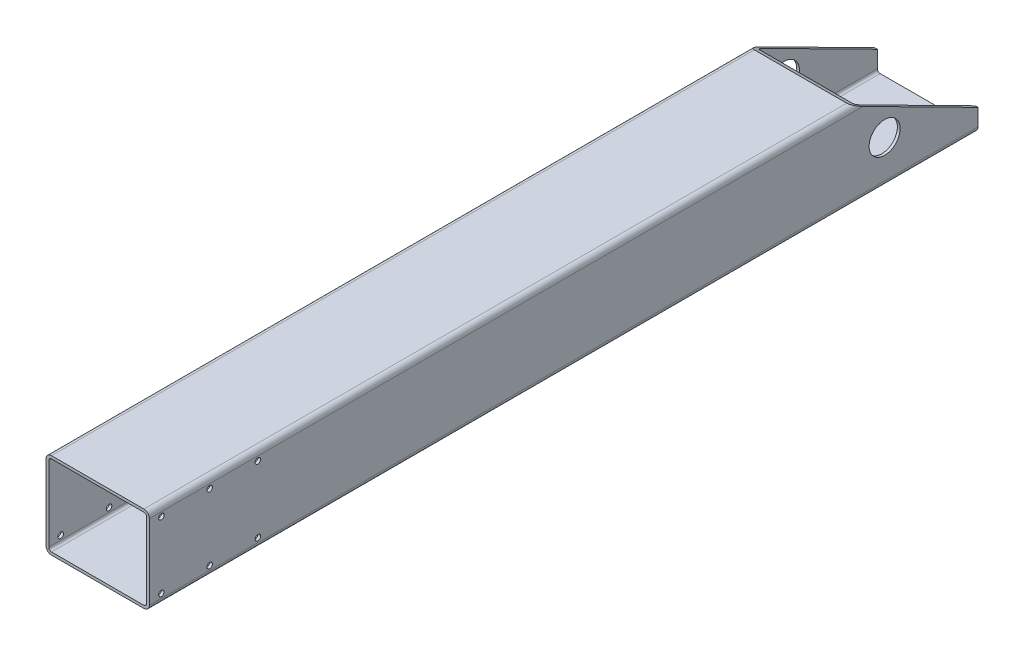
from build123d import *

# Parameters (mm, degrees)
EXTRUDE_1_DEPTH     = 2405
SKETCH_2_R          = 8
SKETCH_2_R_2        = 45
CUT_EXTRUDE_1_DEPTH = 2427.860111337
CUT_EXTRUDE_2_REACH = 2424.607
SKETCH_3_W          = 70
SKETCH_3_H          = 90


with BuildPart() as part:
    # 草图1 → 凸台-拉伸1 (new body)
    with BuildSketch(Plane.XY):
        with BuildLine():
            Line((-134, 125), (134, 125))
            ThreePointArc((134, 125), (145.313708499, 120.313708499), (150, 109))
            Line((150, 109), (150, -109))
            ThreePointArc((150, -109), (145.313708499, -120.313708499), (134, -125))
            Line((134, -125), (-134, -125))
            ThreePointArc((-134, -125), (-145.313708499, -120.313708499), (-150, -109))
            Line((-150, -109), (-150, 109))
            ThreePointArc((-150, 109), (-145.313708499, 120.313708499), (-134, 125))
        make_face()
        with BuildLine():
            Line((-134, 117), (134, 117))
            ThreePointArc((134, 117), (139.656854249, 114.656854249), (142, 109))
            Line((142, 109), (142, -109))
            ThreePointArc((142, -109), (139.656854249, -114.656854249), (134, -117))
            Line((134, -117), (-134, -117))
            ThreePointArc((-134, -117), (-139.656854249, -114.656854249), (-142, -109))
            Line((-142, -109), (-142, 109))
            ThreePointArc((-142, 109), (-139.656854249, 114.656854249), (-134, 117))
        make_face(mode=Mode.SUBTRACT)
    extrude(amount=-EXTRUDE_1_DEPTH)

    # 草图2 → 切除-拉伸1 (cut, through all)
    with BuildSketch(Plane(origin=(150, 0, 0), x_dir=(0, 0, -1), z_dir=(1, 0, 0))):
        with Locations(Location((35, 96.5, 0), (0, 0, 90))):
            Circle(SKETCH_2_R)
        with Locations(Location((175, 96.5, 0), (0, 0, 90))):
            Circle(SKETCH_2_R)
        with Locations(Location((315, 96.5, 0), (0, 0, 90))):
            Circle(SKETCH_2_R)
        with Locations(Location((2134, 0, 0), (0, 0, 90))):
            Circle(SKETCH_2_R_2)
        with Locations(Location((315, -96.5, 0), (0, 0, 180))):
            Circle(SKETCH_2_R)
        with Locations(Location((175, -96.5, 0), (0, 0, 180))):
            Circle(SKETCH_2_R)
        with Locations(Location((35, -96.5, 0), (0, 0, 180))):
            Circle(SKETCH_2_R)
        Polygon((2405, -60), (2040, 125), (2405, 125), align=None)
    extrude(amount=-CUT_EXTRUDE_1_DEPTH, mode=Mode.SUBTRACT)

    # 草图3 → 切除-拉伸2 (cut, up to next)
    with BuildSketch(Plane.XZ.offset(125), mode=Mode.PRIVATE) as cut_extrude_2_sk1:
        with Locations((0, -2025.5)):
            Rectangle(SKETCH_3_W, SKETCH_3_H)
    cut_extrude_2_tool1 = extrude(cut_extrude_2_sk1.sketch, amount=-CUT_EXTRUDE_2_REACH, mode=Mode.PRIVATE) & part.part
    add(cut_extrude_2_tool1.solids().sort_by_distance((0, -125, -2025.5))[0], mode=Mode.SUBTRACT)


solid = part.part
